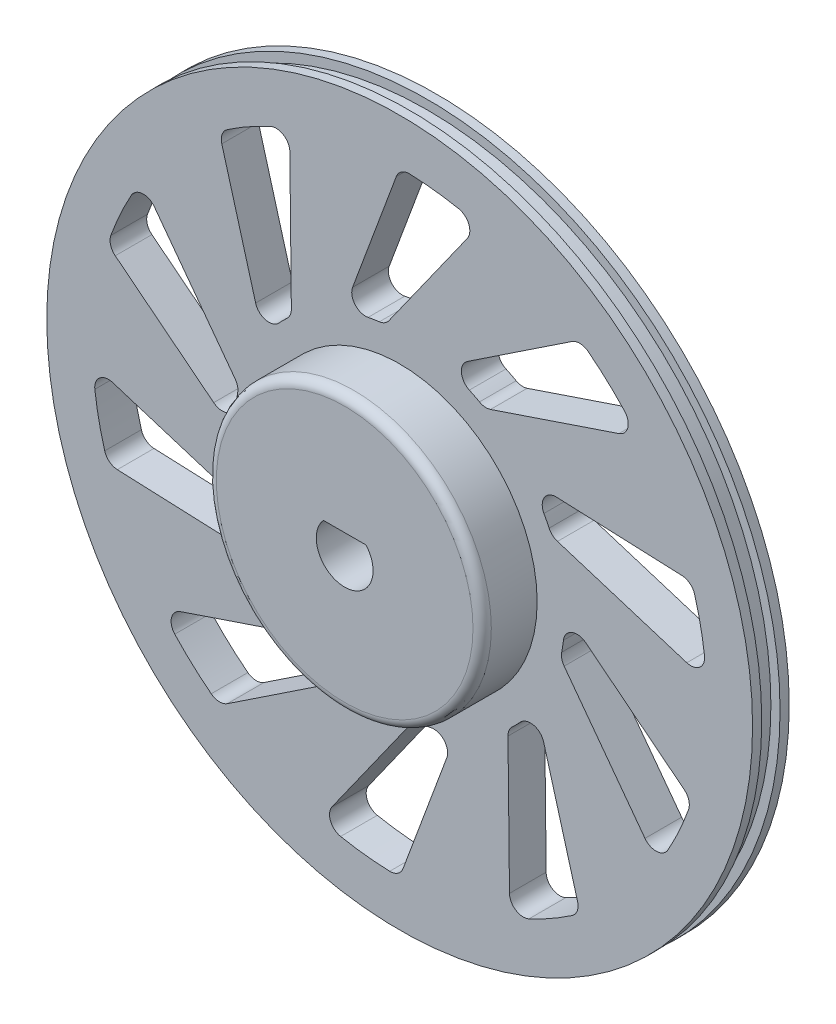
from build123d import *

# Parameters (mm, degrees)
SKETCH_1_R          = 37.5
EXTRUDE_2_DEPTH     = 2
SKETCH_2_R          = 38.5
EXTRUDE_3_DEPTH     = 1
EXTRUDE_START       = 1
SKETCH_3_R          = 38.5
EXTRUDE_4_DEPTH     = 1
SKETCH_6_R          = 15
EXTRUDE_6_DEPTH     = 6
CUT_EXTRUDE_4_DEPTH = 56.357926262
CUT_EXTRUDE_5_DEPTH = 55.776819915
FILLET_1_R          = 1


with BuildPart() as part:
    # Эскиз1 → Бобышка-Вытянуть2 (new body)
    with BuildSketch(Plane.XY):
        Circle(SKETCH_1_R)
    extrude(amount=EXTRUDE_2_DEPTH)

    # Эскиз2 → Бобышка-Вытянуть3 (add)
    with BuildSketch(Plane.XY.offset(2)):
        Circle(SKETCH_2_R)
    extrude(amount=EXTRUDE_3_DEPTH)

    # Эскиз3 → Бобышка-Вытянуть4 (add)
    with BuildSketch(Plane(origin=(0, 0, 0), x_dir=(-1, 0, 0), z_dir=(0, 0, -1)).offset(EXTRUDE_START)):
        with Locations(Location((0, 0, 0), (0, 0, 180))):
            Circle(SKETCH_3_R)
    extrude(amount=-EXTRUDE_4_DEPTH)

    # Эскиз6 → Бобышка-Вытянуть6 (add)
    with BuildSketch(Plane.XY.offset(3)):
        Circle(SKETCH_6_R)
    extrude(amount=EXTRUDE_6_DEPTH)

    # Эскиз4 → Вырез-Вытянуть4 (cut, through all)
    with BuildSketch(Plane(origin=(0, 0, -1), x_dir=(-1, 0, 0), z_dir=(0, 0, -1))):
        with BuildLine():
            Line((2.325403191, 2.05), (-2.325403191, 2.05))
            ThreePointArc((-2.325403191, 2.05), (0, -3.1), (2.325403191, 2.05))
        make_face()
    extrude(amount=-CUT_EXTRUDE_4_DEPTH, mode=Mode.SUBTRACT)

    # Эскиз7 → Вырез-Вытянуть5 (cut, through all)
    with BuildSketch(Plane.XY.offset(3)):
        with BuildLine():
            Line((-1.176998505, 18.48355454), (7.376060937, 30.534748058))
            ThreePointArc((7.376060937, 30.534748058), (7.545800564, 31.959353158), (6.441242798, 32.874920399))
            ThreePointArc((6.441242798, 32.874920399), (3.775653612, 33.286550434), (1.085589359, 33.482405764))
            ThreePointArc((1.085589359, 33.482405764), (0.200595627, 33.228368135), (-0.369267091, 32.50517694))
            Line((-0.369267091, 32.50517694), (-5.136562579, 19.661856752))
            ThreePointArc((-5.136562579, 19.661856752), (-4.873773401, 18.169047963), (-3.44336733, 17.667575426))
            ThreePointArc((-3.44336733, 17.667575426), (-2.831171141, 17.775952013), (-2.215597384, 17.863122018))
            ThreePointArc((-2.215597384, 17.863122018), (-1.630974254, 18.063986965), (-1.176998505, 18.48355454))
        make_face()
        with BuildLine():
            Line((7.401383013, 18.925971985), (18.807320276, 26.5142903))
            ThreePointArc((18.807320276, 26.5142903), (19.693430019, 26.764407365), (20.55872456, 26.44974186))
            ThreePointArc((20.55872456, 26.44974186), (22.619911382, 24.710111474), (24.534468269, 22.810301768))
            ThreePointArc((24.534468269, 22.810301768), (24.889917351, 21.420349546), (23.91523324, 20.367590259))
            Line((23.91523324, 20.367590259), (9.912148976, 15.645332103))
            ThreePointArc((9.912148976, 15.645332103), (9.298259247, 15.572735055), (8.707223745, 15.753864753))
            ThreePointArc((8.707223745, 15.753864753), (8.157976872, 16.045167913), (7.598997591, 16.317329304))
            ThreePointArc((7.598997591, 16.317329304), (6.736532932, 17.563800702), (7.401383013, 18.925971985))
        make_face()
        with BuildLine():
            Line((17.112251857, 10.961009189), (30.800150535, 10.395845953))
            ThreePointArc((30.800150535, 10.395845953), (31.664043498, 10.077352671), (32.179125744, 9.31417556))
            ThreePointArc((32.179125744, 9.31417556), (32.824131826, 6.695249797), (33.256360757, 4.032923156))
            ThreePointArc((33.256360757, 4.032923156), (32.726931688, 2.699500458), (31.319599295, 2.42070525))
            Line((31.319599295, 2.42070525), (17.21519245, 6.831124567))
            ThreePointArc((17.21519245, 6.831124567), (16.675873752, 7.133227651), (16.304181352, 7.627166606))
            ThreePointArc((16.304181352, 7.627166606), (16.031054999, 8.185675025), (15.738803713, 8.734417993))
            ThreePointArc((15.738803713, 8.734417993), (15.773712652, 10.249778544), (17.112251857, 10.961009189))
        make_face()
        with BuildLine():
            Line((20.286822116, -1.190686565), (31.028370149, -9.693458206))
            ThreePointArc((31.028370149, -9.693458206), (31.540068583, -10.458908227), (31.508194622, -11.379089228))
            ThreePointArc((31.508194622, -11.379089228), (30.490649564, -13.876969739), (29.275453778, -16.284895028))
            ThreePointArc((29.275453778, -16.284895028), (28.063370467, -17.052466052), (26.760942933, -16.450806887))
            Line((26.760942933, -16.450806887), (17.94261753, -4.592340372))
            ThreePointArc((17.94261753, -4.592340372), (17.683871276, -4.030930266), (17.673495841, -3.412849946))
            ThreePointArc((17.673495841, -3.412849946), (17.780814992, -2.800467501), (17.866921759, -2.184744119))
            ThreePointArc((17.866921759, -2.184744119), (18.785870268, -0.97931064), (20.286822116, -1.190686565))
        make_face()
        with BuildLine():
            Line((15.712515851, -12.887580522), (19.404806981, -26.080190799))
            ThreePointArc((19.404806981, -26.080190799), (19.368859476, -27.000221668), (18.802204079, -27.725928691))
            ThreePointArc((18.802204079, -27.725928691), (16.510775508, -29.148658496), (14.112318492, -30.382436814))
            ThreePointArc((14.112318492, -30.382436814), (12.680555566, -30.290970122), (11.980515942, -29.038669937))
            Line((11.980515942, -29.038669937), (11.816572561, -14.261687377))
            ThreePointArc((11.816572561, -14.261687377), (11.937231025, -13.655409828), (12.292135619, -13.149273818))
            ThreePointArc((12.292135619, -13.149273818), (12.738908006, -12.716926627), (13.170482967, -12.269408234))
            ThreePointArc((13.170482967, -12.269408234), (14.622463949, -11.834336445), (15.712515851, -12.887580522))
        make_face()
        with BuildLine():
            Line((5.136562579, -19.661856752), (0.369267091, -32.50517694))
            ThreePointArc((0.369267091, -32.50517694), (-0.200595627, -33.228368135), (-1.085589359, -33.482405764))
            ThreePointArc((-1.085589359, -33.482405764), (-3.775653612, -33.286550434), (-6.441242798, -32.874920399))
            ThreePointArc((-6.441242798, -32.874920399), (-7.545800564, -31.959353158), (-7.376060937, -30.534748058))
            Line((-7.376060937, -30.534748058), (1.176998505, -18.48355454))
            ThreePointArc((1.176998505, -18.48355454), (1.630974254, -18.063986965), (2.215597384, -17.863122018))
            ThreePointArc((2.215597384, -17.863122018), (2.831171141, -17.775952013), (3.44336733, -17.667575426))
            ThreePointArc((3.44336733, -17.667575426), (4.873773401, -18.169047963), (5.136562579, -19.661856752))
        make_face()
        with BuildLine():
            Line((-7.401383013, -18.925971985), (-18.807320276, -26.5142903))
            ThreePointArc((-18.807320276, -26.5142903), (-19.693430019, -26.764407365), (-20.55872456, -26.44974186))
            ThreePointArc((-20.55872456, -26.44974186), (-22.619911382, -24.710111474), (-24.534468269, -22.810301768))
            ThreePointArc((-24.534468269, -22.810301768), (-24.889917351, -21.420349546), (-23.91523324, -20.367590259))
            Line((-23.91523324, -20.367590259), (-9.912148976, -15.645332103))
            ThreePointArc((-9.912148976, -15.645332103), (-9.298259247, -15.572735055), (-8.707223745, -15.753864753))
            ThreePointArc((-8.707223745, -15.753864753), (-8.157976872, -16.045167913), (-7.598997591, -16.317329304))
            ThreePointArc((-7.598997591, -16.317329304), (-6.736532932, -17.563800702), (-7.401383013, -18.925971985))
        make_face()
        with BuildLine():
            Line((-17.112251857, -10.961009189), (-30.800150535, -10.395845953))
            ThreePointArc((-30.800150535, -10.395845953), (-31.664043498, -10.077352671), (-32.179125744, -9.31417556))
            ThreePointArc((-32.179125744, -9.31417556), (-32.824131826, -6.695249797), (-33.256360757, -4.032923156))
            ThreePointArc((-33.256360757, -4.032923156), (-32.726931688, -2.699500458), (-31.319599295, -2.42070525))
            Line((-31.319599295, -2.42070525), (-17.21519245, -6.831124567))
            ThreePointArc((-17.21519245, -6.831124567), (-16.675873752, -7.133227651), (-16.304181352, -7.627166606))
            ThreePointArc((-16.304181352, -7.627166606), (-16.031054999, -8.185675025), (-15.738803713, -8.734417993))
            ThreePointArc((-15.738803713, -8.734417993), (-15.773712652, -10.249778544), (-17.112251857, -10.961009189))
        make_face()
        with BuildLine():
            Line((-20.286822116, 1.190686565), (-31.028370149, 9.693458206))
            ThreePointArc((-31.028370149, 9.693458206), (-31.540068583, 10.458908227), (-31.508194622, 11.379089228))
            ThreePointArc((-31.508194622, 11.379089228), (-30.490649564, 13.876969739), (-29.275453778, 16.284895028))
            ThreePointArc((-29.275453778, 16.284895028), (-28.063370467, 17.052466052), (-26.760942933, 16.450806887))
            Line((-26.760942933, 16.450806887), (-17.94261753, 4.592340372))
            ThreePointArc((-17.94261753, 4.592340372), (-17.683871276, 4.030930266), (-17.673495841, 3.412849946))
            ThreePointArc((-17.673495841, 3.412849946), (-17.780814992, 2.800467501), (-17.866921759, 2.184744119))
            ThreePointArc((-17.866921759, 2.184744119), (-18.785870268, 0.97931064), (-20.286822116, 1.190686565))
        make_face()
        with BuildLine():
            Line((-15.712515851, 12.887580522), (-19.404806981, 26.080190799))
            ThreePointArc((-19.404806981, 26.080190799), (-19.368859476, 27.000221668), (-18.802204079, 27.725928691))
            ThreePointArc((-18.802204079, 27.725928691), (-16.510775508, 29.148658496), (-14.112318492, 30.382436814))
            ThreePointArc((-14.112318492, 30.382436814), (-12.680555566, 30.290970122), (-11.980515942, 29.038669937))
            Line((-11.980515942, 29.038669937), (-11.816572561, 14.261687377))
            ThreePointArc((-11.816572561, 14.261687377), (-11.937231025, 13.655409828), (-12.292135619, 13.149273818))
            ThreePointArc((-12.292135619, 13.149273818), (-12.738908006, 12.716926627), (-13.170482967, 12.269408234))
            ThreePointArc((-13.170482967, 12.269408234), (-14.622463949, 11.834336445), (-15.712515851, 12.887580522))
        make_face()
    extrude(amount=-CUT_EXTRUDE_5_DEPTH, mode=Mode.SUBTRACT)

    # Скругление1
    fillet_1_edges = [part.edges().sort_by_distance(p)[0] for p in [
        (-15, 0, 9),
    ]]
    fillet(fillet_1_edges, radius=FILLET_1_R)


solid = part.part
